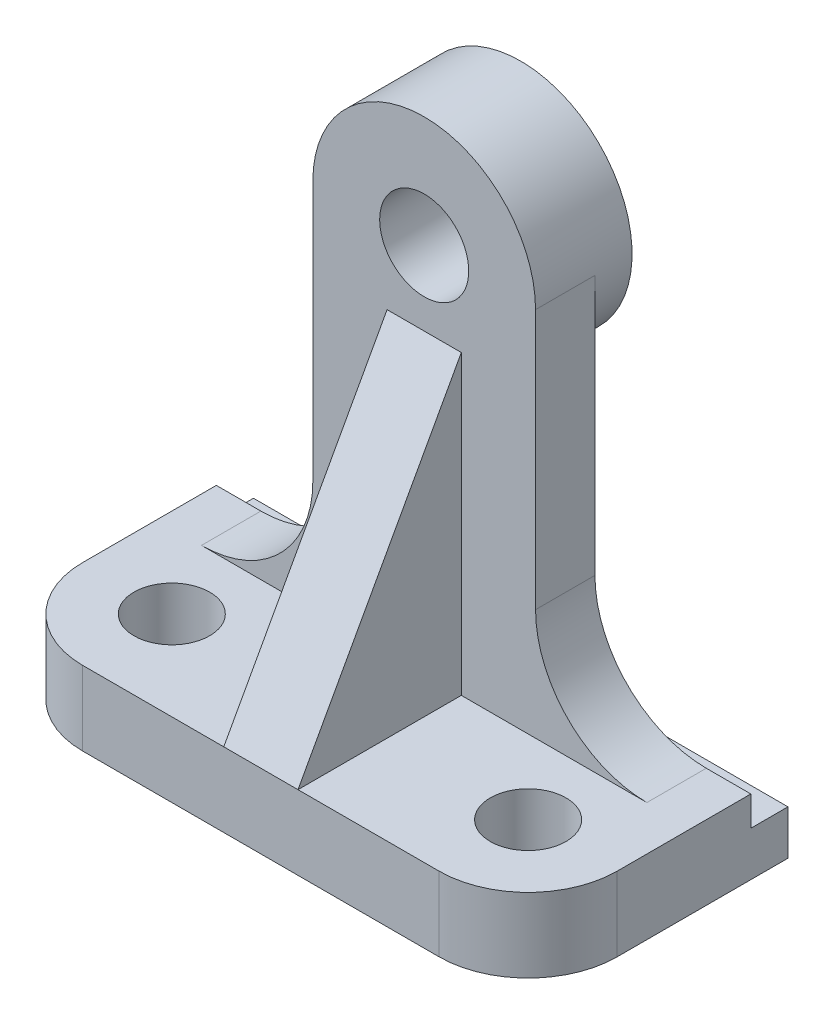
from build123d import *

# Parameters (mm, degrees)
SKETCH1_R           = 5.1
BOSS_EXTRUDE1_DEPTH = 10
SKETCH2_W           = 5
SKETCH2_H           = 4
CUT_EXTRUDE1_DEPTH  = 75.767974428
SKETCH3_R           = 6
BOSS_EXTRUDE2_DEPTH = 8
BOSS_EXTRUDE4_START = 5
SKETCH4_R           = 6
BOSS_EXTRUDE4_DEPTH = 5
RIB1_REACH          = 87.013
SKETCH7_WALL_W      = 217.67731737
SKETCH7_WALL_H      = 10


with BuildPart() as part:
    # Sketch1 → Boss-Extrude1 (new body)
    with BuildSketch(Plane(origin=(0, 0, 0), x_dir=(1, 0, 0), z_dir=(0, 1, 0))):
        with BuildLine():
            Line((36, 17.5), (-36, 17.5))
            Line((-36, 17.5), (-36, -5.5))
            ThreePointArc((-36, -5.5), (-32.485281374, -13.985281374), (-24, -17.5))
            Line((-24, -17.5), (24, -17.5))
            ThreePointArc((24, -17.5), (32.485281374, -13.985281374), (36, -5.5))
            Line((36, -5.5), (36, 17.5))
        make_face()
        with Locations(Location((-24, -5.5, 0), (0, 0, 270))):
            Circle(SKETCH1_R, mode=Mode.SUBTRACT)
        with Locations(Location((24, -5.5, 0), (0, 0, 270))):
            Circle(SKETCH1_R, mode=Mode.SUBTRACT)
    extrude(amount=BOSS_EXTRUDE1_DEPTH)

    # Sketch2 → Cut-Extrude1 (cut, through all)
    with BuildSketch(Plane.ZY.offset(36)):
        with Locations((-15, 8)):
            Rectangle(SKETCH2_W, SKETCH2_H)
    extrude(amount=-CUT_EXTRUDE1_DEPTH, mode=Mode.SUBTRACT)

    # Sketch3 → Boss-Extrude2 (add)
    with BuildSketch(Plane(origin=(0, 0, -12.5), x_dir=(-1, 0, 0), z_dir=(0, 0, -1))):
        with BuildLine():
            Line((-15, 60), (-15, 25))
            ThreePointArc((-15, 25), (-19.393398282, 14.393398282), (-30, 10))
            Line((-30, 10), (30, 10))
            ThreePointArc((30, 10), (19.393398282, 14.393398282), (15, 25))
            Line((15, 25), (15, 60))
            ThreePointArc((15, 60), (0, 75), (-15, 60))
        make_face()
        with Locations((0, 60)):
            Circle(SKETCH3_R, mode=Mode.SUBTRACT)
    extrude(amount=-BOSS_EXTRUDE2_DEPTH)

    # Sketch4 → Boss-Extrude4 (add)
    with BuildSketch(Plane(origin=(0, 0, -12.5), x_dir=(-1, 0, 0), z_dir=(0, 0, -1)).offset(BOSS_EXTRUDE4_START)):
        with BuildLine():
            ThreePointArc((15, 60), (0, 75), (-15, 60))
            ThreePointArc((-15, 60), (0, 45), (15, 60))
        make_face()
        with Locations((0, 60)):
            Circle(SKETCH4_R, mode=Mode.SUBTRACT)
    extrude(amount=-BOSS_EXTRUDE4_DEPTH)

    # Sketch7 wall → Rib1 (add, up to next)
    with BuildSketch(Plane(origin=(0, 30, 6.5), x_dir=(0, 0.876215908677, -0.481918749772), z_dir=(0, 0.481918749772, 0.876215908677)), mode=Mode.PRIVATE) as rib1_sk1:
        Rectangle(SKETCH7_WALL_W, SKETCH7_WALL_H)
    rib1_tool1 = extrude(rib1_sk1.sketch, amount=-RIB1_REACH, mode=Mode.PRIVATE) - part.part
    add(rib1_tool1.solids().sort_by_distance((0, 30, 6.5))[0])


solid = part.part
